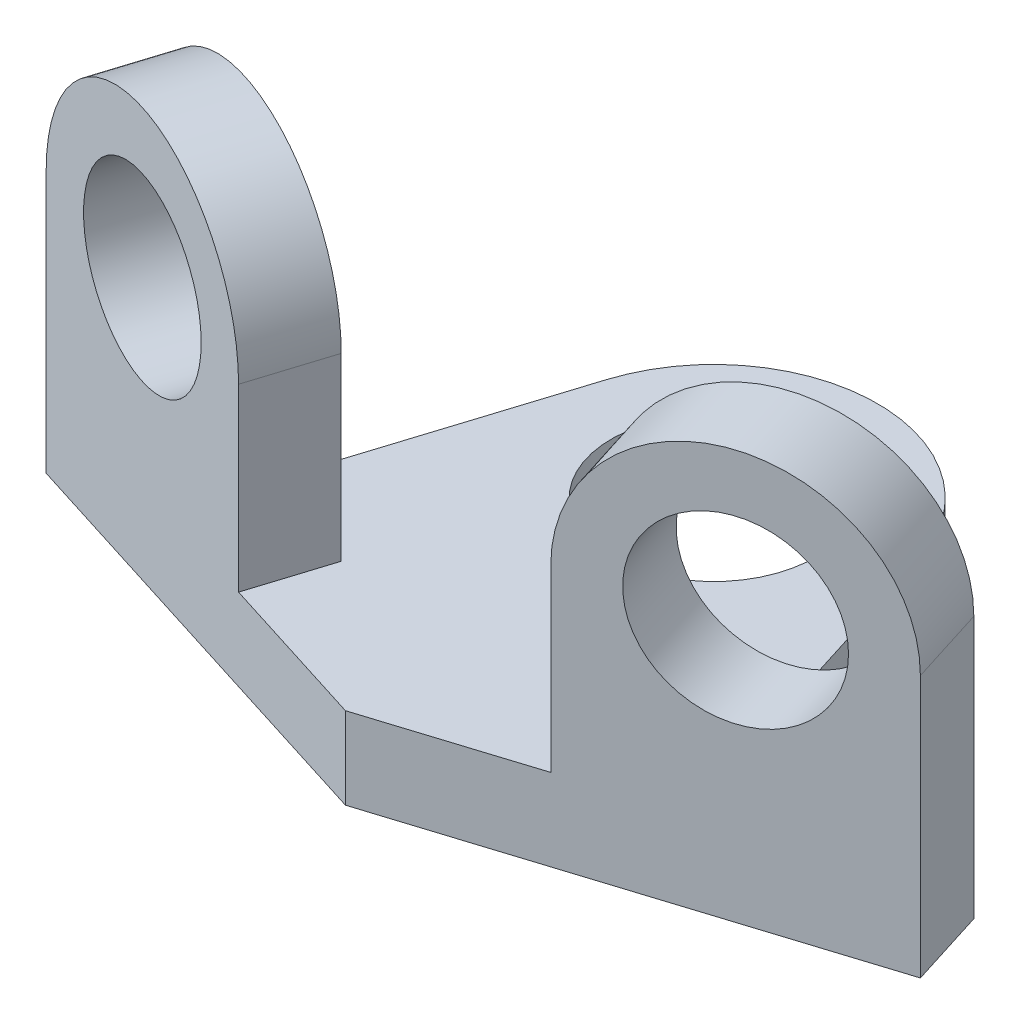
from build123d import *

# Parameters (mm, degrees)
SZKIC3_R                    = 12.5
DODANIE_WYCI_GNI_CIE1_DEPTH = 10
SZKIC4_R                    = 11
DODANIE_WYCI_GNI_CIE2_DEPTH = 10
SZKIC5_R                    = 11
DODANIE_WYCI_GNI_CIE3_DEPTH = 10


with BuildPart() as part:
    # Szkic3 → Dodanie-wyciągnięcie1 (new body)
    with BuildSketch(Plane(origin=(0, 0, 0), x_dir=(1, 0, 0), z_dir=(0, 1, 0))):
        with BuildLine():
            Line((0, 0), (31.979808833, 10.083194994))
            Line((31.979808833, 10.083194994), (19.074339015, 51.01411599))
            ThreePointArc((19.074339015, 51.01411599), (0, 65), (-19.074339015, 51.01411599))
            Line((-19.074339015, 51.01411599), (-31.979808833, 10.083194994))
            Line((-31.979808833, 10.083194994), (0, 0))
        make_face()
        with Locations(Location((0, 45, 0), (0, 0, 270))):
            Circle(SZKIC3_R, mode=Mode.SUBTRACT)
    extrude(amount=DODANIE_WYCI_GNI_CIE1_DEPTH)

    # Szkic4 → Dodanie-wyciągnięcie2 (add)
    with BuildSketch(Plane(origin=(0, 0, 0), x_dir=(0.9537169507482276, 0, -0.3007057995042709), z_dir=(0.3007057995042709, 0, 0.9537169507482276))):
        with BuildLine():
            Line((20, 0), (56, 0))
            Line((56, 0), (56, 32))
            ThreePointArc((56, 32), (38, 50), (20, 32))
            Line((20, 32), (20, 0))
        make_face()
        with Locations((38, 32)):
            Circle(SZKIC4_R, mode=Mode.SUBTRACT)
    extrude(amount=-DODANIE_WYCI_GNI_CIE2_DEPTH)

    # Szkic5 → Dodanie-wyciągnięcie3 (add)
    with BuildSketch(Plane(origin=(0, 0, 0), x_dir=(0.9537169507482279, 0, 0.30070579950427034), z_dir=(-0.30070579950427034, 0, 0.9537169507482279))):
        with BuildLine():
            Line((-20, 0), (-56, 0))
            Line((-56, 0), (-56, 32))
            ThreePointArc((-56, 32), (-38, 50), (-20, 32))
            Line((-20, 32), (-20, 0))
        make_face()
        with Locations((-38, 32)):
            Circle(SZKIC5_R, mode=Mode.SUBTRACT)
    extrude(amount=-DODANIE_WYCI_GNI_CIE3_DEPTH)


solid = part.part
